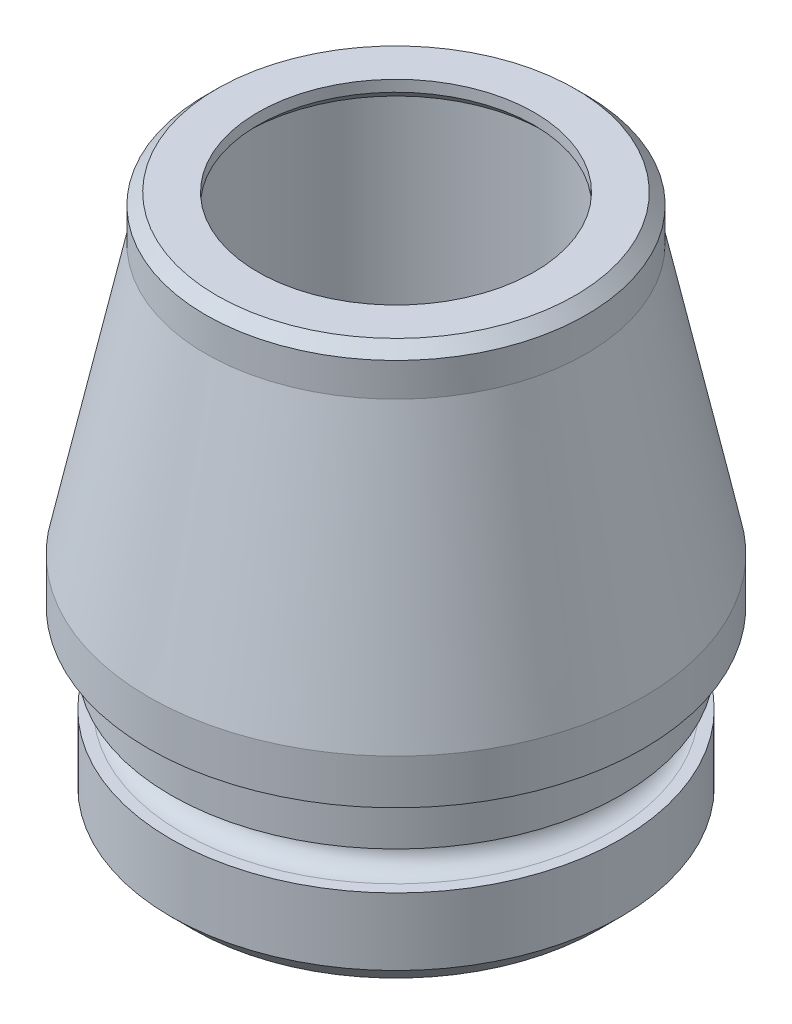
from build123d import *

# Parameters (mm, degrees)
CHAMFER_1_SIZE = 1
CHAMFER_2_SIZE = 0.5
FILLET_1_R     = 0.3
CHAMFER_3_SIZE = 0.5


with BuildPart() as part:
    # 스케치1 → 회전1 (revolve)
    with BuildSketch(Plane(origin=(0, 0, 0), x_dir=(0, 0, -1), z_dir=(1, 0, 0))):
        with BuildLine():
            Line((7.1, 0), (7.1, 23))
            Line((7.1, 23), (6.175, 23))
            Line((6.175, 23), (6.175, 24))
            Line((6.175, 24), (8.5, 24))
            Line((8.5, 24), (8.5, 22))
            Line((8.5, 22), (11.05, 10))
            Line((11.05, 10), (11.05, 8))
            Line((11.05, 8), (10.05, 8))
            Line((10.05, 8), (10.05, 5.7))
            Line((10.05, 5.7), (9.55, 5.7))
            ThreePointArc((9.55, 5.7), (8.7, 4.85), (9.55, 4))
            Line((9.55, 4), (10.05, 4))
            Line((10.05, 4), (10.05, 0))
            Line((10.05, 0), (7.1, 0))
        make_face()
    revolve(axis=Axis((0, 0, 0), (0, 1, 0)))

    # 모따기1
    chamfer_1_edges = [part.edges().sort_by_distance(p)[0] for p in [
        (0, 0, 10.05),
    ]]
    chamfer(chamfer_1_edges, length=CHAMFER_1_SIZE)

    # 모따기2
    chamfer_2_edges = [part.edges().sort_by_distance(p)[0] for p in [
        (0, 24, 8.5),
    ]]
    chamfer(chamfer_2_edges, length=CHAMFER_2_SIZE)

    # 필렛1
    fillet_1_edges = [part.edges().sort_by_distance(p)[0] for p in [
        (0, 0, 7.1),
    ]]
    fillet(fillet_1_edges, radius=FILLET_1_R)

    # 모따기3
    chamfer_3_edges = [part.edges().sort_by_distance(p)[0] for p in [
        (0, 23, 6.175),
    ]]
    chamfer(chamfer_3_edges, length=CHAMFER_3_SIZE)


solid = part.part
